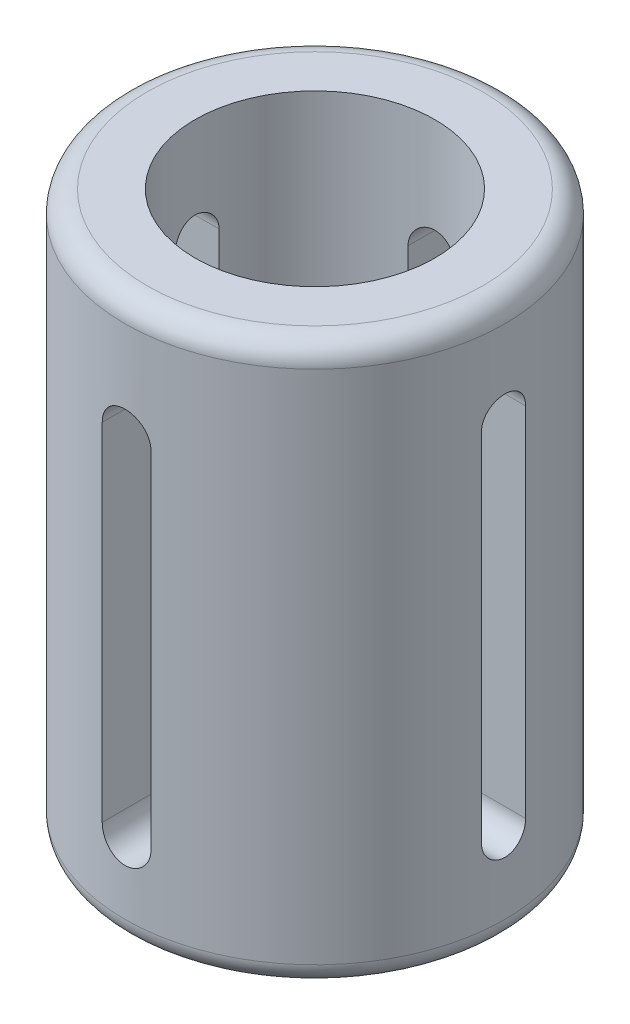
from build123d import *

# Parameters (mm, degrees)
SKETCH_1_R               = 9.5
SKETCH_1_R_2             = 6
EXTRUDE_1_DEPTH          = 28
FILLET_1_R               = 1.1
CUT_EXTRUDE_1_DEPTH      = 15
CUT_EXTRUDE_1_DEPTH_BACK = 17
CUT_EXTRUDE_2_DEPTH      = 17
CUT_EXTRUDE_2_DEPTH_BACK = 17


with BuildPart() as part:
    # Эскиз1 → Бобышка-Вытянуть1 (new body)
    with BuildSketch(Plane(origin=(0, 0, 0), x_dir=(1, 0, 0), z_dir=(0, 1, 0))):
        with Locations(Location((0, 0, 0), (0, 0, 270))):
            Circle(SKETCH_1_R)
        with Locations(Location((0, 0, 0), (0, 0, 270))):
            Circle(SKETCH_1_R_2, mode=Mode.SUBTRACT)
    extrude(amount=EXTRUDE_1_DEPTH)

    # Скругление1
    fillet_1_edges = [part.edges().sort_by_distance(p)[0] for p in [
        (0, 0, -9.5),
        (0, 28, -9.5),
    ]]
    fillet(fillet_1_edges, radius=FILLET_1_R)

    # Эскиз2 → Вырез-Вытянуть1 (cut, two sides: drawn at the far end of the back side and taken through both)
    with BuildSketch(Plane.XY.offset(-CUT_EXTRUDE_1_DEPTH_BACK)):
        with BuildLine():
            Line((1.218447758, 21.987601969), (1.218447758, 4.658567189))
            ThreePointArc((1.218447758, 4.658567189), (0, 3.440119431), (-1.218447758, 4.658567189))
            Line((-1.218447758, 4.658567189), (-1.218447758, 21.987601969))
            ThreePointArc((-1.218447758, 21.987601969), (0, 23.206049726), (1.218447758, 21.987601969))
        make_face()
    extrude(amount=CUT_EXTRUDE_1_DEPTH + CUT_EXTRUDE_1_DEPTH_BACK, mode=Mode.SUBTRACT)

    # Эскиз3 → Вырез-Вытянуть2 (cut, two sides: drawn at the far end of the back side and taken through both)
    with BuildSketch(Plane(origin=(0, 0, 0), x_dir=(0, 0, -1), z_dir=(1, 0, 0)).offset(-CUT_EXTRUDE_2_DEPTH_BACK)):
        with BuildLine():
            Line((1.102405114, 22.761219593), (1.102405114, 4.890652477))
            ThreePointArc((1.102405114, 4.890652477), (0, 3.788247362), (-1.102405114, 4.890652477))
            Line((-1.102405114, 4.890652477), (-1.102405114, 22.761219593))
            ThreePointArc((-1.102405114, 22.761219593), (0, 23.863624707), (1.102405114, 22.761219593))
        make_face()
    extrude(amount=CUT_EXTRUDE_2_DEPTH + CUT_EXTRUDE_2_DEPTH_BACK, mode=Mode.SUBTRACT)


solid = part.part
